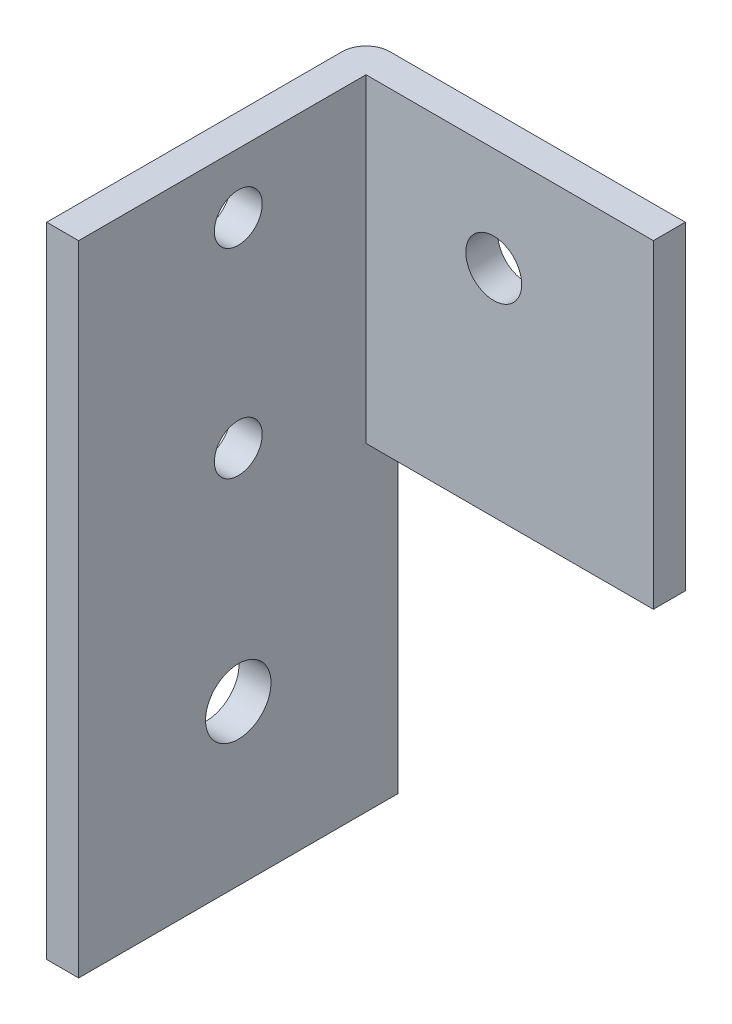
from build123d import *

# Parameters (mm, degrees)
EXTRUDE_THIN1_DEPTH   = 80
SKETCH5_R             = 4.1
SKETCH5_R_2           = 3
CUT_EXTRUDE2_DEPTH    = 10
SKETCH6_W             = 57.412547925
SKETCH6_H             = 40
CUT_EXTRUDE3_DEPTH    = 10
M8X1_0_TAPPED_HOLE3_D = 7


with BuildPart() as part:
    # Sketch1 → Extrude-Thin1 (new body)
    with BuildSketch(Plane(origin=(0, 0, 0), x_dir=(1, 0, 0), z_dir=(0, 1, 0))):
        with BuildLine():
            Line((-22.658959538, -16.878612717), (-22.658959538, 20.121387283))
            ThreePointArc((-22.658959538, 20.121387283), (-21.780279881, 22.242707627), (-19.658959538, 23.121387283))
            Line((-19.658959538, 23.121387283), (17.341040462, 23.121387283))
            Line((17.341040462, 23.121387283), (17.341040462, 19.121387283))
            Line((17.341040462, 19.121387283), (-18.658959538, 19.121387283))
            Line((-18.658959538, 19.121387283), (-18.658959538, -16.878612717))
            Line((-18.658959538, -16.878612717), (-22.658959538, -16.878612717))
        make_face()
    extrude(amount=EXTRUDE_THIN1_DEPTH)

    # Sketch5 → Cut-Extrude2 (cut)
    with BuildSketch(Plane.ZY.offset(22.658959538)):
        with Locations((-3.121387283, 20)):
            Circle(SKETCH5_R)
        with Locations((-3.121387283, 47.5)):
            Circle(SKETCH5_R_2)
        with Locations((-3.121387283, 72.5)):
            Circle(SKETCH5_R_2)
    extrude(amount=-CUT_EXTRUDE2_DEPTH, mode=Mode.SUBTRACT)

    # Sketch6 → Cut-Extrude3 (cut)
    with BuildSketch(Plane(origin=(0, 0, -23.121387283), x_dir=(-1, 0, 0), z_dir=(0, 0, -1))):
        with Locations((-10.047314424, 20)):
            Rectangle(SKETCH6_W, SKETCH6_H)
    extrude(amount=-CUT_EXTRUDE3_DEPTH, mode=Mode.SUBTRACT)

    # M8x1.0 Tapped Hole3 (through all)
    with Locations(Plane(origin=(0, 0, -23.121387283), x_dir=(-1, 0, 0), z_dir=(0, 0, -1))):
        with Locations((2.658959538, 67)):
            Hole(M8X1_0_TAPPED_HOLE3_D / 2)


solid = part.part
